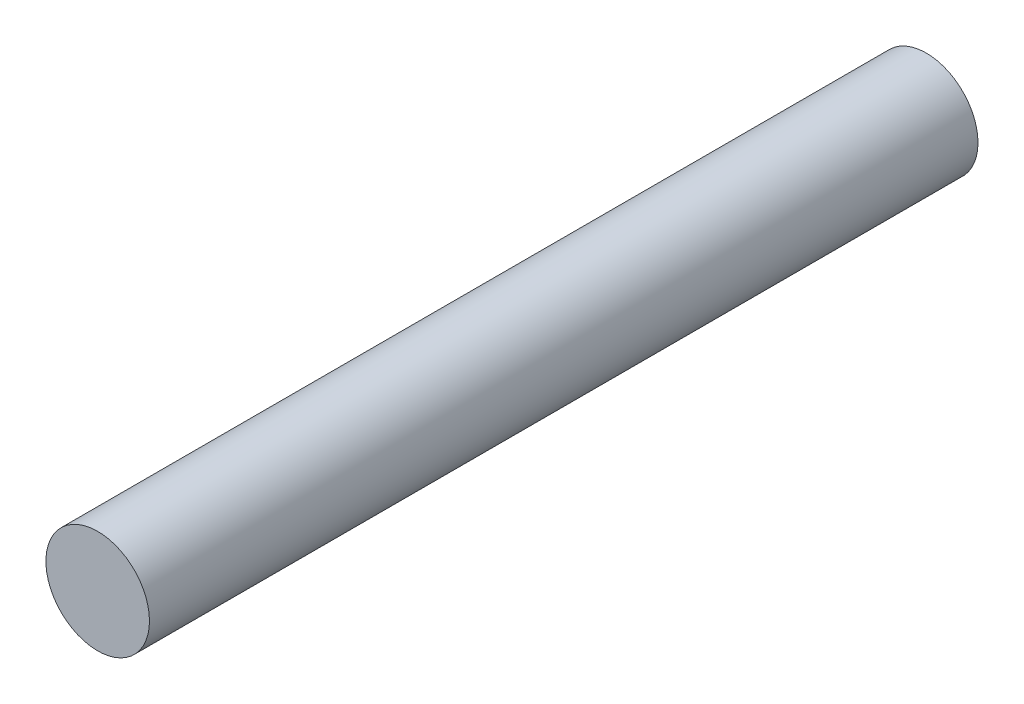
from build123d import *

# Parameters (mm, degrees)
ESQUISSE1_R        = 2.5
BOSS_EXTRU_1_DEPTH = 40


with BuildPart() as part:
    # Esquisse1 → Boss.-Extru.1 (new body)
    with BuildSketch(Plane.XY):
        Circle(ESQUISSE1_R)
    extrude(amount=BOSS_EXTRU_1_DEPTH)


solid = part.part
